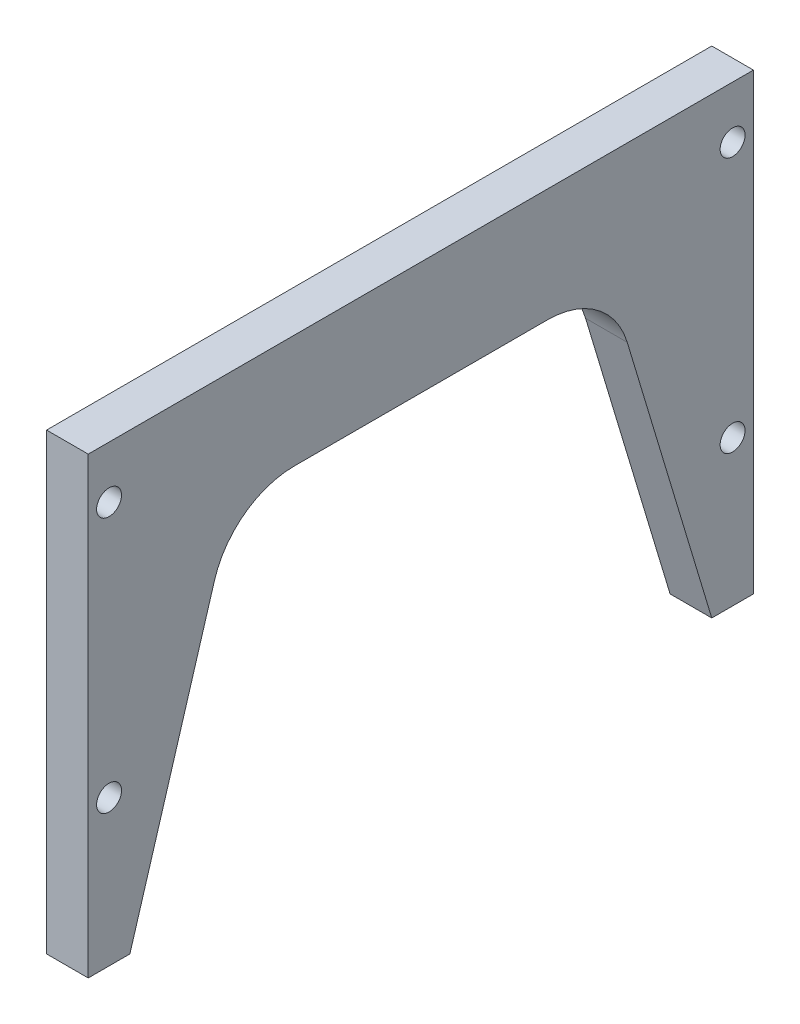
from build123d import *

# Parameters (mm, degrees)
BOSS_EXTRUDE1_DEPTH       = 6.35
F_6_CLEARANCE_HOLE1_D     = 3.7973
F_6_CLEARANCE_HOLE1_DEPTH = 9.398
F_6_CLEARANCE_HOLE1_TIP   = 1.140824014


with BuildPart() as part:
    # Sketch1 → Boss-Extrude1 (new body)
    with BuildSketch(Plane.ZY.offset(60.933137827)):
        Polygon((-95.039403682, -15.875), (-95.039403682, 46.928467802), (-6.35, 46.928467802), (-6.35, -15.875), (0, -15.875), (0, 53.278467802), (-101.389403682, 53.278467802), (-101.389403682, -15.875), align=None)
        with BuildLine():
            Line((-6.35, 46.928467802), (-95.039403682, 46.928467802))
            Line((-95.039403682, 46.928467802), (-95.039403682, -15.875))
            Line((-95.039403682, -15.875), (-82.154349913, 26.960143079))
            ThreePointArc((-82.154349913, 26.960143079), (-77.569908616, 33.493757292), (-69.992656184, 36.001836689))
            Line((-69.992656184, 36.001836689), (-31.396747499, 36.001836689))
            ThreePointArc((-31.396747499, 36.001836689), (-23.819495066, 33.493757292), (-19.23505377, 26.960143079))
            Line((-19.23505377, 26.960143079), (-6.35, -15.875))
            Line((-6.35, -15.875), (-6.35, 46.928467802))
        make_face()
    extrude(amount=BOSS_EXTRUDE1_DEPTH)

    # #6 Clearance Hole1
    with Locations(Plane.ZY.offset(67.283137827)):
        with Locations((-3.175, 45.340967802), (-3.175, 6.35), (-98.214403682, 6.35), (-98.214403682, 45.340967802)):
            Hole(F_6_CLEARANCE_HOLE1_D / 2, depth=F_6_CLEARANCE_HOLE1_DEPTH)
            with Locations((0, 0, -(F_6_CLEARANCE_HOLE1_DEPTH + F_6_CLEARANCE_HOLE1_TIP / 2))):  # 118° drill point
                Cone(0, F_6_CLEARANCE_HOLE1_D / 2, F_6_CLEARANCE_HOLE1_TIP, mode=Mode.SUBTRACT)


solid = part.part
